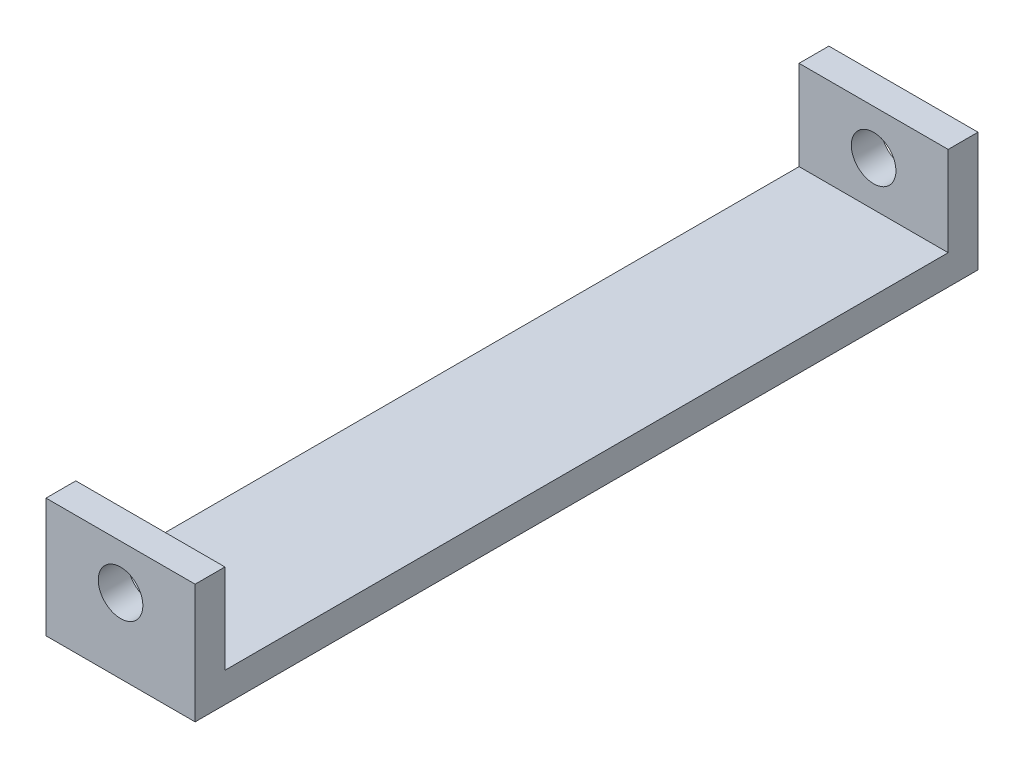
from build123d import *

# Parameters (mm, degrees)
EXTRUDE_THIN1_DEPTH       = 12.7
F_6_CLEARANCE_HOLE1_D     = 3.7973
F_6_CLEARANCE_HOLE1_DEPTH = 7.62
F_6_CLEARANCE_HOLE1_TIP   = 1.140824014
F_6_CLEARANCE_HOLE2_D     = 3.7973
F_6_CLEARANCE_HOLE2_DEPTH = 7.62
F_6_CLEARANCE_HOLE2_TIP   = 1.140824014


with BuildPart() as part:
    # Sketch1 → Extrude-Thin1 (new body)
    with BuildSketch(Plane(origin=(0, 0, 0), x_dir=(0, 0, -1), z_dir=(1, 0, 0))):
        Polygon((-1.27, 15.748), (-1.27, 8.128), (60.325, 8.128), (60.325, 15.748), (62.865, 15.748), (62.865, 5.588), (-3.81, 5.588), (-3.81, 15.748), align=None)
    extrude(amount=EXTRUDE_THIN1_DEPTH)

    # #6 Clearance Hole1
    with Locations(Plane(origin=(0, 0, 1.27), x_dir=(-1, 0, 0), z_dir=(0, 0, -1))):
        with Locations((-6.35, 11.938)):
            Hole(F_6_CLEARANCE_HOLE1_D / 2, depth=F_6_CLEARANCE_HOLE1_DEPTH)
            with Locations((0, 0, -(F_6_CLEARANCE_HOLE1_DEPTH + F_6_CLEARANCE_HOLE1_TIP / 2))):  # 118° drill point
                Cone(0, F_6_CLEARANCE_HOLE1_D / 2, F_6_CLEARANCE_HOLE1_TIP, mode=Mode.SUBTRACT)

    # #6 Clearance Hole2
    with Locations(Plane.XY.offset(-60.325)):
        with Locations((6.35, 11.938)):
            Hole(F_6_CLEARANCE_HOLE2_D / 2, depth=F_6_CLEARANCE_HOLE2_DEPTH)
            with Locations((0, 0, -(F_6_CLEARANCE_HOLE2_DEPTH + F_6_CLEARANCE_HOLE2_TIP / 2))):  # 118° drill point
                Cone(0, F_6_CLEARANCE_HOLE2_D / 2, F_6_CLEARANCE_HOLE2_TIP, mode=Mode.SUBTRACT)


solid = part.part
